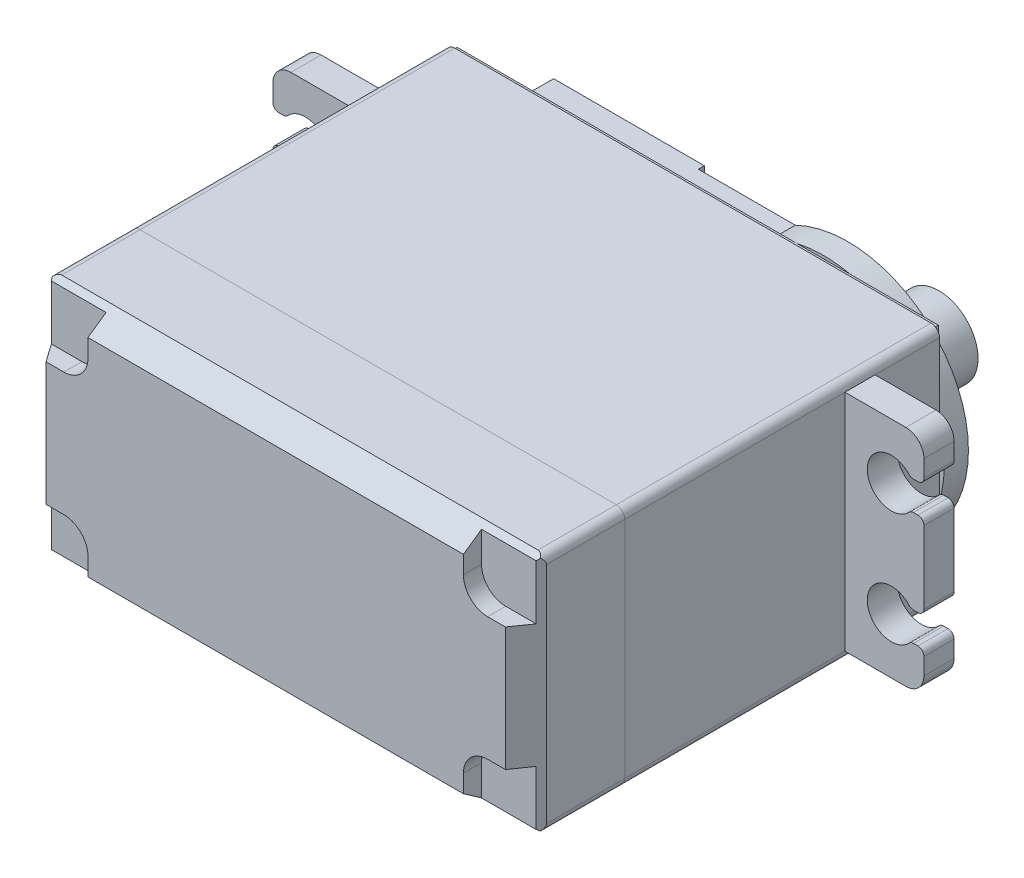
from build123d import *
from OCP.BRepFilletAPI import BRepFilletAPI_MakeChamfer

# Parameters (mm, degrees)
SKETCH1_W            = 40.9
SKETCH1_H            = 20
BOSS_EXTRUDE1_DEPTH  = 19.3
SKETCH4_W            = 40.9
SKETCH4_H            = 20
BOSS_EXTRUDE2_DEPTH  = 6.8
SKETCH5_W            = 40.9
SKETCH5_H            = 20
BOSS_EXTRUDE3_DEPTH  = 8.5
CHAMFER1_SIZE        = 2
CHAMFER1_SIZE2       = 1.400415076
CUT_EXTRUDE1_DEPTH   = 1.5
SKETCH8_W            = 39.9
SKETCH8_H            = 19.5
BOSS_EXTRUDE4_DEPTH  = 0.4
BOSS_EXTRUDE5_DEPTH  = 2
SKETCH11_R           = 6.5
BOSS_EXTRUDE6_DEPTH  = 1.5
SKETCH12_R           = 5.5
BOSS_EXTRUDE7_DEPTH  = 0.5
SKETCH13_R           = 3.25
BOSS_EXTRUDE8_DEPTH  = 5
SKETCH14_W           = 10.5
SKETCH14_H           = 15.998933302
BOSS_EXTRUDE9_DEPTH  = 0.5
FILLET1_R            = 0.7
FILLET2_R            = 0.7
FILLET3_R            = 0.7
BOSS_EXTRUDE10_START = -5.74
BOSS_EXTRUDE10_DEPTH = 2.5


with BuildPart() as part:
    # Sketch1 → Boss-Extrude1 (new body)
    with BuildSketch(Plane.XY):
        Rectangle(SKETCH1_W, SKETCH1_H)
    extrude(amount=BOSS_EXTRUDE1_DEPTH)

    # Fillet1
    fillet1_edges = [part.edges().sort_by_distance(p)[0] for p in [
        (20.45, -10, 9.65),
        (-20.45, -10, 9.65),
        (-20.45, 10, 9.65),
        (20.45, 10, 9.65),
    ]]
    fillet(fillet1_edges, radius=FILLET1_R)



with BuildPart() as body_2:
    # Sketch4 → Boss-Extrude2 (new body)
    with BuildSketch(Plane(origin=(0, 0, 0), x_dir=(-1, 0, 0), z_dir=(0, 0, -1))):
        Rectangle(SKETCH4_W, SKETCH4_H)
    extrude(amount=BOSS_EXTRUDE2_DEPTH)

    # Sketch8 → Boss-Extrude4 (add)
    with BuildSketch(Plane(origin=(0, 0, -6.8), x_dir=(-1, 0, 0), z_dir=(0, 0, -1))):
        Rectangle(SKETCH8_W, SKETCH8_H)
    extrude(amount=BOSS_EXTRUDE4_DEPTH)

    # Sketch9 → Boss-Extrude5 (add)
    with BuildSketch(Plane(origin=(0, 0, -7.2), x_dir=(-1, 0, 0), z_dir=(0, 0, -1))):
        with BuildLine():
            Line((-6.09, 8.999466651), (14.45, 8.999466651))
            Line((14.45, 8.999466651), (14.45, 3))
            ThreePointArc((14.45, 3), (17.45, 0), (14.45, -3))
            Line((14.45, -3), (14.45, -8.999466651))
            Line((14.45, -8.999466651), (-6.09, -8.999466651))
            ThreePointArc((-6.09, -8.999466651), (-20.45, 0), (-6.09, 8.999466651))
        make_face()
    extrude(amount=BOSS_EXTRUDE5_DEPTH)

    # Sketch11 → Boss-Extrude6 (add)
    with BuildSketch(Plane(origin=(0, 0, -9.2), x_dir=(-1, 0, 0), z_dir=(0, 0, -1))):
        with Locations((-10.999432969, 0)):
            Circle(SKETCH11_R)
    extrude(amount=BOSS_EXTRUDE6_DEPTH)

    # Sketch12 → Boss-Extrude7 (add)
    with BuildSketch(Plane(origin=(0, 0, -10.7), x_dir=(-1, 0, 0), z_dir=(0, 0, -1))):
        with Locations((-10.999432969, 0)):
            Circle(SKETCH12_R)
    extrude(amount=BOSS_EXTRUDE7_DEPTH)

    # Sketch13 → Boss-Extrude8 (add)
    with BuildSketch(Plane(origin=(0, 0, -11.2), x_dir=(-1, 0, 0), z_dir=(0, 0, -1))):
        with Locations((-10.999432969, 0)):
            Circle(SKETCH13_R)
    extrude(amount=BOSS_EXTRUDE8_DEPTH)

    # Sketch14 → Boss-Extrude9 (add)
    with BuildSketch(Plane(origin=(0, 0, -9.2), x_dir=(-1, 0, 0), z_dir=(0, 0, -1))):
        with BuildLine():
            Line((14.45, -8.999466651), (14.45, 8.999466651))
            Line((14.45, 8.999466651), (1.95, 8.999466651))
            Line((1.95, 8.999466651), (1.95, 1.75))
            ThreePointArc((1.95, 1.75), (0.2, 0), (1.95, -1.75))
            Line((1.95, -1.75), (1.95, -8.999466651))
            Line((1.95, -8.999466651), (14.45, -8.999466651))
        make_face()
        with Locations((8.2, 0)):
            Rectangle(SKETCH14_W, SKETCH14_H, mode=Mode.SUBTRACT)
    extrude(amount=BOSS_EXTRUDE9_DEPTH)

    # Fillet2
    fillet2_edges = [body_2.edges().sort_by_distance(p)[0] for p in [
        (-20.45, 10, -3.4),
        (-20.45, -10, -3.4),
        (20.45, -10, -3.4),
        (20.45, 10, -3.4),
    ]]
    fillet(fillet2_edges, radius=FILLET2_R)


with BuildPart() as body_3:
    # Sketch5 → Boss-Extrude3 (new body)
    with BuildSketch(Plane.XY.offset(19.3)):
        Rectangle(SKETCH5_W, SKETCH5_H)
    extrude(amount=BOSS_EXTRUDE3_DEPTH)

    # Chamfer1: one chamfer whose edges measure the first distance from different faces: ONE call of the kernel's chamfer builder (chamfer() names one face for all edges)
    chamfer1_edges_1 = [body_3.edges().sort_by_distance(p)[0] for p in [
        (0, 10, 27.8),
    ]]
    chamfer1_side_1 = [body_3.faces().sort_by_distance(p)[0] for p in [
        (0, 10, 23.55),
    ]]
    chamfer1_edges_2 = [body_3.edges().sort_by_distance(p)[0] for p in [
        (-20.45, 0, 27.8),
    ]]
    chamfer1_side_2 = [body_3.faces().sort_by_distance(p)[0] for p in [
        (-20.45, 0, 23.55),
    ]]
    chamfer1_edges_3 = [body_3.edges().sort_by_distance(p)[0] for p in [
        (0, -10, 27.8),
    ]]
    chamfer1_side_3 = [body_3.faces().sort_by_distance(p)[0] for p in [
        (0, -10, 23.55),
    ]]
    chamfer1_edges_4 = [body_3.edges().sort_by_distance(p)[0] for p in [
        (20.45, 0, 27.8),
    ]]
    chamfer1_side_4 = [body_3.faces().sort_by_distance(p)[0] for p in [
        (20.45, 0, 23.55),
    ]]
    chamfer1 = BRepFilletAPI_MakeChamfer(body_3.part.solid().wrapped)
    for e in chamfer1_edges_1:
        chamfer1.Add(CHAMFER1_SIZE, CHAMFER1_SIZE2, e.wrapped, chamfer1_side_1[0].wrapped)  # the first distance lies on this face
    for e in chamfer1_edges_2:
        chamfer1.Add(CHAMFER1_SIZE, CHAMFER1_SIZE2, e.wrapped, chamfer1_side_2[0].wrapped)  # the first distance lies on this face
    for e in chamfer1_edges_3:
        chamfer1.Add(CHAMFER1_SIZE, CHAMFER1_SIZE2, e.wrapped, chamfer1_side_3[0].wrapped)  # the first distance lies on this face
    for e in chamfer1_edges_4:
        chamfer1.Add(CHAMFER1_SIZE, CHAMFER1_SIZE2, e.wrapped, chamfer1_side_4[0].wrapped)  # the first distance lies on this face
    add(Compound.cast(chamfer1.Shape()), mode=Mode.REPLACE)

    # Sketch7 → Cut-Extrude1 (cut)
    with BuildSketch(Plane.XY.offset(27.8)):
        with BuildLine():
            Line((-20.45, 10), (-15.57, 10))
            Line((-15.57, 10), (-15.57, 7.12))
            ThreePointArc((-15.57, 7.12), (-16.155786438, 5.705786438), (-17.57, 5.12))
            Line((-17.57, 5.12), (-20.45, 5.12))
            Line((-20.45, 5.12), (-20.45, 10))
        make_face()
        with BuildLine():
            Line((15.57, 10), (15.57, 7.12))
            ThreePointArc((15.57, 7.12), (16.155786438, 5.705786438), (17.57, 5.12))
            Line((17.57, 5.12), (20.45, 5.12))
            Line((20.45, 5.12), (20.45, 10))
            Line((20.45, 10), (15.57, 10))
        make_face()
        with BuildLine():
            Line((-15.57, -10), (-15.57, -7.12))
            ThreePointArc((-15.57, -7.12), (-16.155786438, -5.705786438), (-17.57, -5.12))
            Line((-17.57, -5.12), (-20.45, -5.12))
            Line((-20.45, -5.12), (-20.45, -10))
            Line((-20.45, -10), (-15.57, -10))
        make_face()
        with BuildLine():
            Line((20.45, -10), (15.57, -10))
            Line((15.57, -10), (15.57, -7.12))
            ThreePointArc((15.57, -7.12), (16.155786438, -5.705786438), (17.57, -5.12))
            Line((17.57, -5.12), (20.45, -5.12))
            Line((20.45, -5.12), (20.45, -10))
        make_face()
    extrude(amount=-CUT_EXTRUDE1_DEPTH, mode=Mode.SUBTRACT)

    # Fillet3
    fillet3_edges = [body_3.edges().sort_by_distance(p)[0] for p in [
        (-20.45, -10, 22.55),
        (-20.45, 10, 22.55),
        (20.45, 10, 22.55),
        (20.45, -10, 22.55),
    ]]
    fillet(fillet3_edges, radius=FILLET3_R)


with BuildPart() as part_1:
    add(part.part)

    add(body_2.part)  # Boss-Extrude10 merges body 2
    # Sketch15 → Boss-Extrude10 (add)
    with BuildSketch(Plane(origin=(0, 0, -7.2), x_dir=(-1, 0, 0), z_dir=(0, 0, -1)).offset(BOSS_EXTRUDE10_START)):
        with BuildLine():
            Line((20.45, 9.3), (25.5, 9.3))
            ThreePointArc((25.5, 9.3), (26.560660172, 8.860660172), (27, 7.8))
            Line((27, 7.8), (27, 6.4))
            ThreePointArc((27, 6.4), (26.853553391, 6.046446609), (26.5, 5.9))
            Line((26.5, 5.9), (26.133030278, 5.9))
            ThreePointArc((26.133030278, 5.9), (25.933030278, 5.941742431), (25.766424222, 6.06))
            ThreePointArc((25.766424222, 6.06), (22.3, 4.7), (25.766424222, 3.34))
            ThreePointArc((25.766424222, 3.34), (25.933030278, 3.458257569), (26.133030278, 3.5))
            Line((26.133030278, 3.5), (26.5, 3.5))
            ThreePointArc((26.5, 3.5), (26.853553391, 3.353553391), (27, 3))
            Line((27, 3), (27, -3))
            ThreePointArc((27, -3), (26.853553391, -3.353553391), (26.5, -3.5))
            Line((26.5, -3.5), (26.133030278, -3.5))
            ThreePointArc((26.133030278, -3.5), (25.933030278, -3.458257569), (25.766424222, -3.34))
            ThreePointArc((25.766424222, -3.34), (22.3, -4.7), (25.766424222, -6.06))
            ThreePointArc((25.766424222, -6.06), (25.933030278, -5.941742431), (26.133030278, -5.9))
            Line((26.133030278, -5.9), (26.5, -5.9))
            ThreePointArc((26.5, -5.9), (26.853553391, -6.046446609), (27, -6.4))
            Line((27, -6.4), (27, -7.8))
            ThreePointArc((27, -7.8), (26.560660172, -8.860660172), (25.5, -9.3))
            Line((25.5, -9.3), (20.45, -9.3))
            Line((20.45, -9.3), (20.45, 9.3))
        make_face()
    boss_extrude10 = extrude(amount=-BOSS_EXTRUDE10_DEPTH)

    # Mirror1: Boss-Extrude10 across plane
    add(boss_extrude10.mirror(Plane(origin=(0, 0, 0), x_dir=(0, 0, 1), z_dir=(1, 0, 0))))


solid = Compound([body_3.part, part_1.part])
